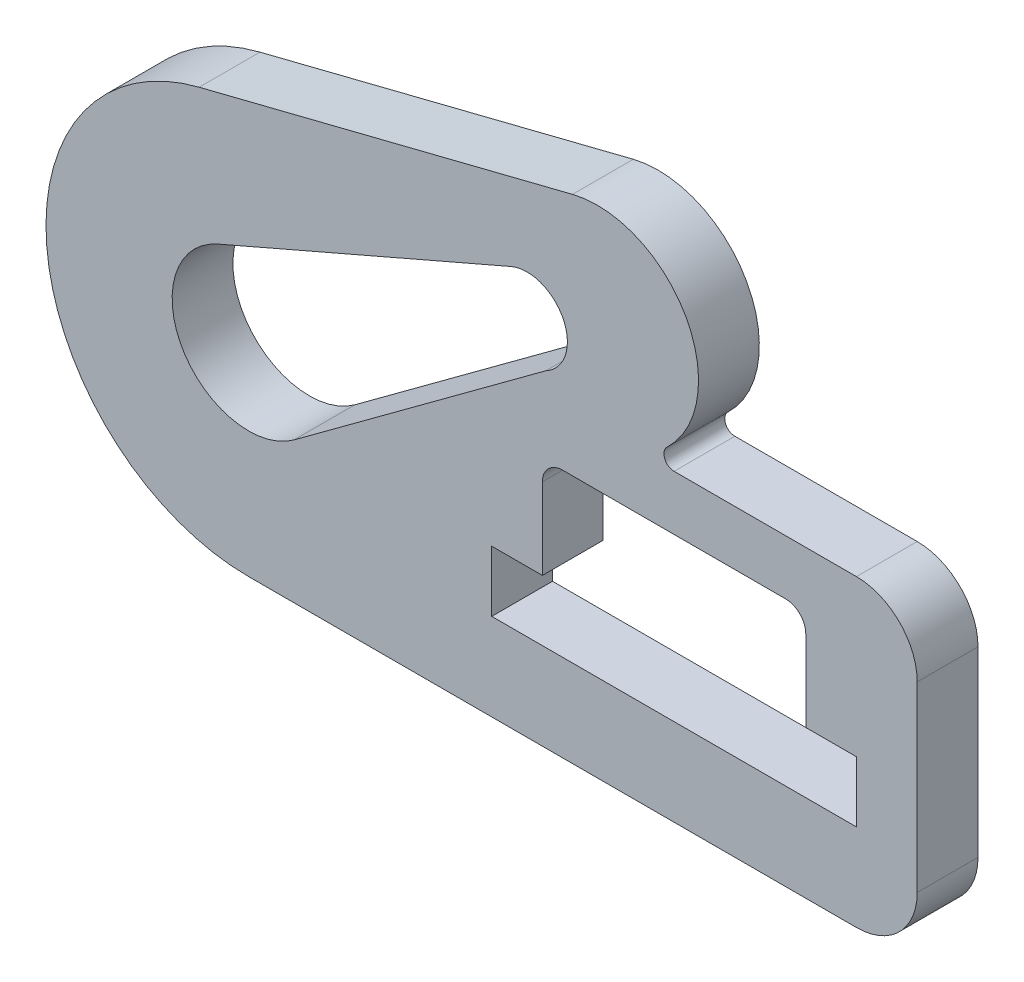
from build123d import *

# Parameters (mm, degrees)
BOSS_EXTRUDE1_DEPTH = 3
SKETCH2_R           = 1.5
CUT_EXTRUDE1_DEPTH  = 3
CUT_EXTRUDE2_DEPTH  = 3
SKETCH5_W           = 18
SKETCH5_H           = 3
CUT_EXTRUDE3_DEPTH  = 3
CUT_EXTRUDE5_DEPTH  = 3


with BuildPart() as part:
    # Sketch1 → Boss-Extrude1 (new body)
    with BuildSketch(Plane.XY):
        with BuildLine():
            Line((3.868741846, 4.666984775), (3.868741846, -4.333015225))
            ThreePointArc((3.868741846, -4.333015225), (2.990062189, -6.454335569), (0.868741846, -7.333015225))
            Line((0.868741846, -7.333015225), (-29.131258154, -7.333015225))
            ThreePointArc((-29.131258154, -7.333015225), (-39.055484202, 1.438271074), (-31.570064658, 12.365037303))
            Line((-31.570064658, 12.365037303), (-13.143764854, 16.998769659))
            ThreePointArc((-13.143764854, 16.998769659), (-7.545321729, 14.563041923), (-8.476085741, 8.52905374))
            ThreePointArc((-8.476085741, 8.52905374), (-8.5954965, 7.981289437), (-8.131258154, 7.666984775))
            Line((-8.131258154, 7.666984775), (0.868741846, 7.666984775))
            ThreePointArc((0.868741846, 7.666984775), (2.990062189, 6.788305118), (3.868741846, 4.666984775))
        make_face()
    extrude(amount=BOSS_EXTRUDE1_DEPTH)

    # Sketch2 → Cut-Extrude1 (cut)
    with BuildSketch(Plane.XY.offset(3)):
        with Locations((-29.131258154, 2.666984775)):
            Circle(SKETCH2_R)
    extrude(amount=-CUT_EXTRUDE1_DEPTH, mode=Mode.SUBTRACT)

    # Sketch4 → Cut-Extrude2 (cut)
    with BuildSketch(Plane(origin=(0, 0, 0), x_dir=(-1, 0, 0), z_dir=(0, 0, -1))):
        with BuildLine():
            Line((30.632745307, 6.129616333), (16.185458015, 12.394336069))
            ThreePointArc((16.185458015, 12.394336069), (13.596850059, 11.433034125), (14.450350699, 8.806909749))
            Line((14.450350699, 8.806909749), (26.890771517, -0.370201523))
            ThreePointArc((26.890771517, -0.370201523), (32.402104849, 0.783943915), (30.632745307, 6.129616333))
        make_face()
    extrude(amount=-CUT_EXTRUDE2_DEPTH, mode=Mode.SUBTRACT)

    # Sketch5 → Cut-Extrude3 (cut)
    with BuildSketch(Plane.XY.offset(3)):
        with Locations((-8.131258154, -1.533015225)):
            Rectangle(SKETCH5_W, SKETCH5_H)
    extrude(amount=-CUT_EXTRUDE3_DEPTH, mode=Mode.SUBTRACT)

    # Sketch7 → Cut-Extrude5 (cut)
    with BuildSketch(Plane.XY.offset(3)):
        with BuildLine():
            Line((-14.631258154, -0.033015225), (-14.631258154, 3.966984775))
            ThreePointArc((-14.631258154, 3.966984775), (-14.338364936, 4.674091556), (-13.631258154, 4.966984775))
            Line((-13.631258154, 4.966984775), (-2.631258154, 4.966984775))
            ThreePointArc((-2.631258154, 4.966984775), (-1.924151373, 4.674091556), (-1.631258154, 3.966984775))
            Line((-1.631258154, 3.966984775), (-1.631258154, -0.033015225))
            Line((-1.631258154, -0.033015225), (-14.631258154, -0.033015225))
        make_face()
    extrude(amount=-CUT_EXTRUDE5_DEPTH, mode=Mode.SUBTRACT)


solid = part.part
